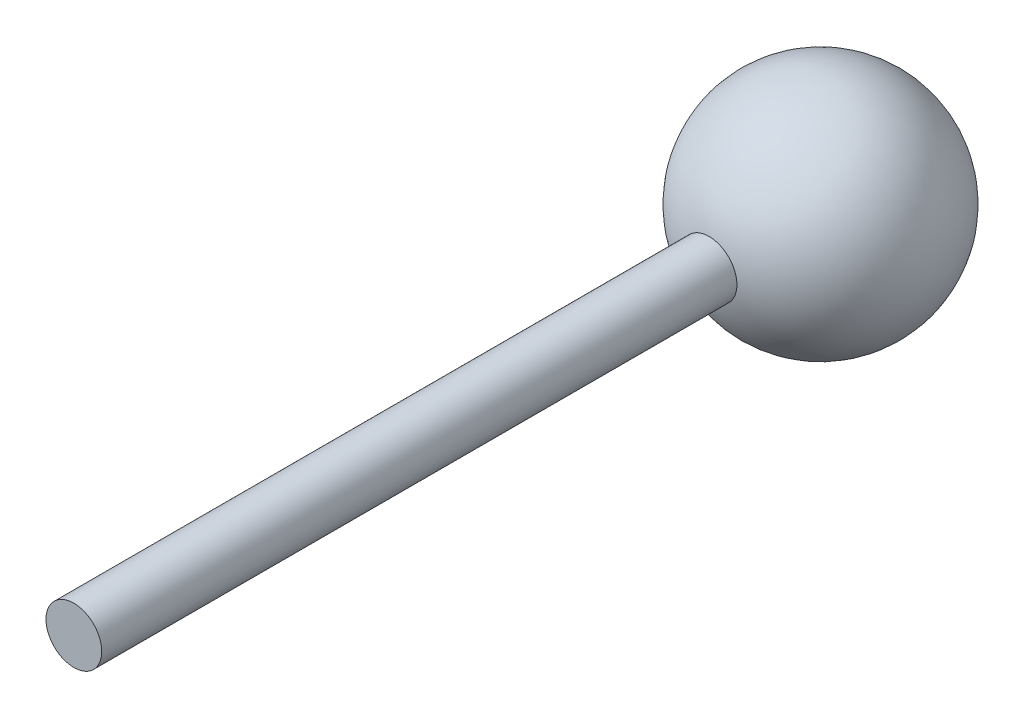
from build123d import *

# Parameters (mm, degrees)
SKETCH3_R           = 2.5
BOSS_EXTRUDE2_DEPTH = 57


with BuildPart() as part:
    # Sketch1 → Revolve1 (revolve)
    with BuildSketch(Plane.XY):
        with BuildLine():
            Line((10, 0), (-10, 0))
            ThreePointArc((-10, 0), (0, -10), (10, 0))
        make_face()
    revolve(axis=Axis((-10, 0, 0), (1, 0, 0)))


with BuildPart() as body_2:
    # Sketch3 → Boss-Extrude2 (new body)
    with BuildSketch(Plane.XY.offset(10)):
        with Locations(Location((0, 0, 0), (0, 0, 180))):
            Circle(SKETCH3_R)
    extrude(amount=BOSS_EXTRUDE2_DEPTH)


solid = Compound([part.part, body_2.part])
